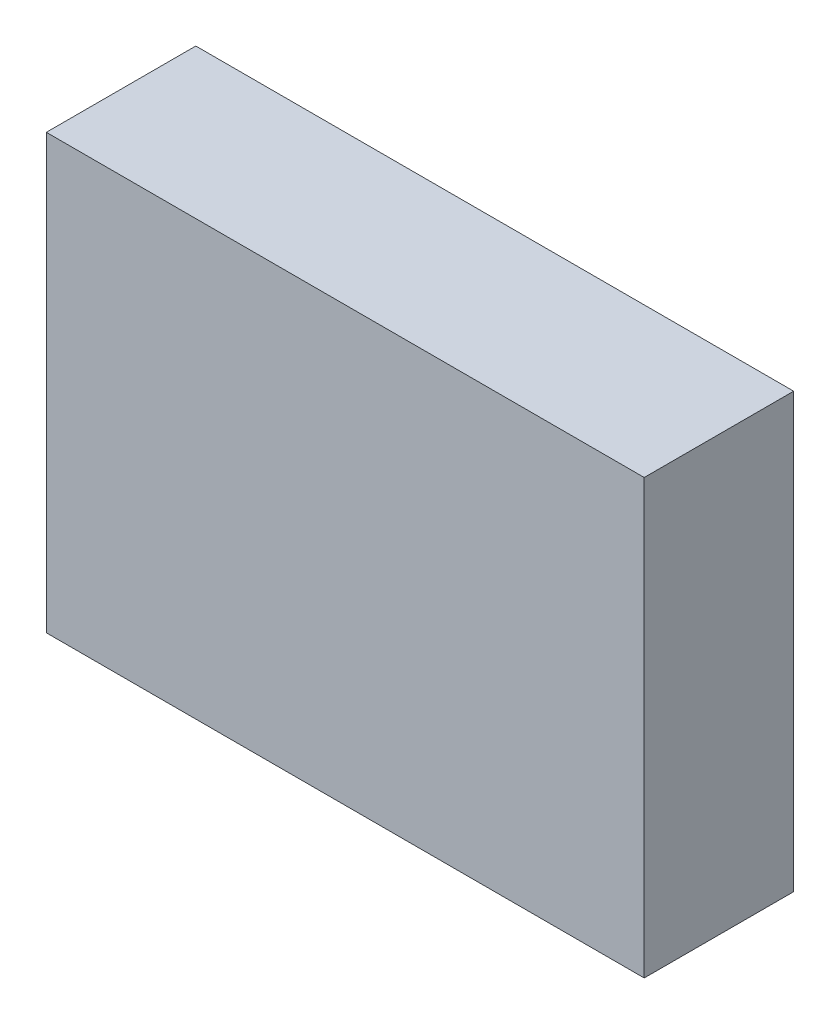
from build123d import *

# Parameters (mm, degrees)
SKETCH1_W           = 40
SKETCH1_H           = 29
BOSS_EXTRUDE1_DEPTH = 10


with BuildPart() as part:
    # Sketch1 → Boss-Extrude1 (new body)
    with BuildSketch(Plane.XY):
        with Locations((20, 14.5)):
            Rectangle(SKETCH1_W, SKETCH1_H)
    extrude(amount=-BOSS_EXTRUDE1_DEPTH)


solid = part.part
